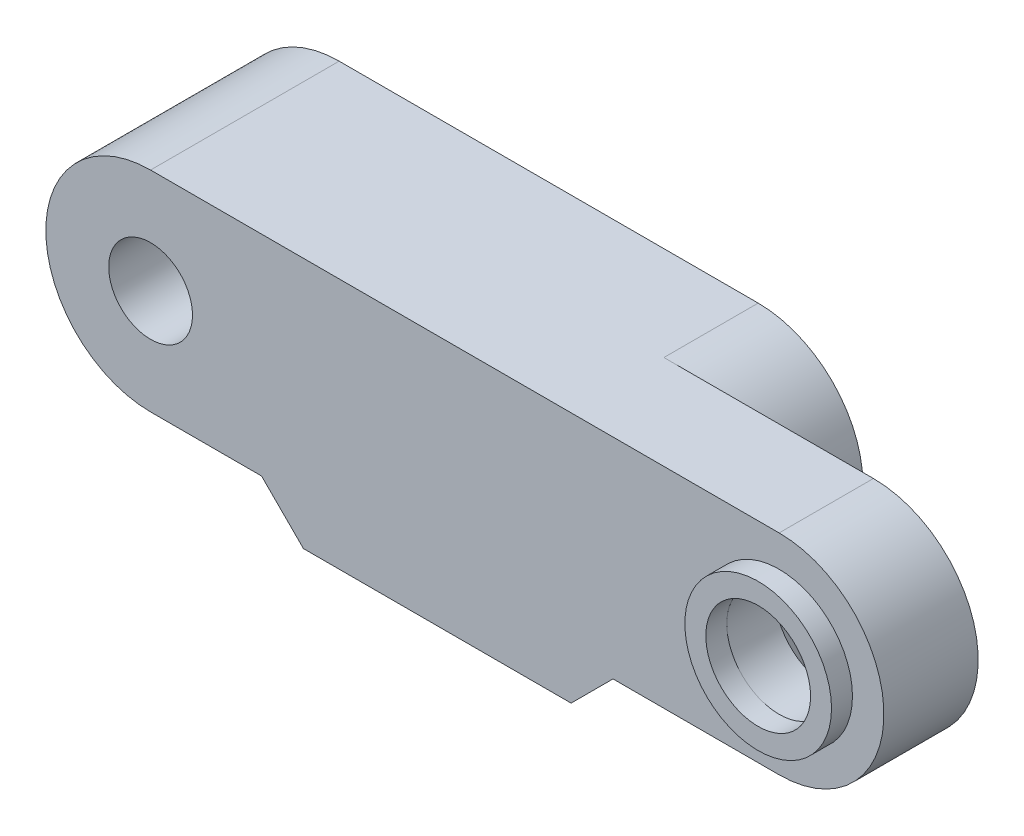
from build123d import *

# Parameters (mm, degrees)
P_IDAT_VYSUNUT_M1_DEPTH                           = 9
SKICA2_R                                          = 2
SKICA2_R_2                                        = 2.55
ODEBRAT_VYSUNUT_M1_DEPTH                          = 10
SKICA4_OUTSIDE_W                                  = 50.44
SKICA4_OUTSIDE_H                                  = 20.44
ODEBRAT_VYSUNUT_M5_DEPTH                          = 4.5
KU_ELOV_ZAHLOUBEN_PRO_M4_ROUBU_SE_Z_P_D           = 4.5
KU_ELOV_ZAHLOUBEN_PRO_M4_ROUBU_SE_Z_P_DEPTH       = 13.5
KU_ELOV_ZAHLOUBEN_PRO_M4_ROUBU_SE_Z_P_CSINK_D     = 9.4
KU_ELOV_ZAHLOUBEN_PRO_M4_ROUBU_SE_Z_P_CSINK_ANGLE = 90
KU_ELOV_ZAHLOUBEN_PRO_M4_ROUBU_SE_Z_P_TIP         = 1.351936393
SKICA14_R                                         = 3.5
SKICA14_R_2                                       = 2.5
P_IDAT_VYSUNUT_M3_DEPTH                           = 1
P_IDAT_VYSUNUT_M5_REACH                           = 38.742
SKICA15_R                                         = 2


with BuildPart() as part:
    # Skica1 → Přidat vysunutím1 (new body)
    with BuildSketch(Plane.XY):
        with BuildLine():
            Line((0, 5), (30, 5))
            ThreePointArc((30, 5), (35, 0), (30, -5))
            Line((30, -5), (0, -5))
            ThreePointArc((0, -5), (-5, 0), (0, 5))
        make_face()
    extrude(amount=P_IDAT_VYSUNUT_M1_DEPTH)

    # Skica2 → Odebrat vysunutím1 (cut)
    with BuildSketch(Plane.XY.offset(9)):
        Circle(SKICA2_R)
        with Locations((30, 0)):
            Circle(SKICA2_R_2)
    extrude(amount=-ODEBRAT_VYSUNUT_M1_DEPTH, mode=Mode.SUBTRACT)

    # Skica4 outside → Odebrat vysunutím5 (cut)
    with BuildSketch(Plane(origin=(0, 0, 0), x_dir=(-1, 0, 0), z_dir=(0, 0, -1))):
        with Locations((-15, 0)):
            Rectangle(SKICA4_OUTSIDE_W, SKICA4_OUTSIDE_H)
        with BuildLine():
            Line((0, -5), (-20, -5))
            ThreePointArc((-20, -5), (-25, 0), (-20, 5))
            Line((-20, 5), (0, 5))
            ThreePointArc((0, 5), (5, 0), (0, -5))
        make_face(mode=Mode.SUBTRACT)
    extrude(amount=-ODEBRAT_VYSUNUT_M5_DEPTH, mode=Mode.SUBTRACT)

    # Kuželové zahloubení pro M4 šroubu se zápustnou hlavou plochou1
    with Locations(Plane(origin=(0, 0, 4.5), x_dir=(-1, 0, 0), z_dir=(0, 0, -1))):
        with Locations((-30, 0)):
            CounterSinkHole(KU_ELOV_ZAHLOUBEN_PRO_M4_ROUBU_SE_Z_P_D / 2, KU_ELOV_ZAHLOUBEN_PRO_M4_ROUBU_SE_Z_P_CSINK_D / 2, depth=KU_ELOV_ZAHLOUBEN_PRO_M4_ROUBU_SE_Z_P_DEPTH, counter_sink_angle=KU_ELOV_ZAHLOUBEN_PRO_M4_ROUBU_SE_Z_P_CSINK_ANGLE)
            with Locations((0, 0, -(KU_ELOV_ZAHLOUBEN_PRO_M4_ROUBU_SE_Z_P_DEPTH + KU_ELOV_ZAHLOUBEN_PRO_M4_ROUBU_SE_Z_P_TIP / 2))):  # 118° drill point
                Cone(0, KU_ELOV_ZAHLOUBEN_PRO_M4_ROUBU_SE_Z_P_D / 2, KU_ELOV_ZAHLOUBEN_PRO_M4_ROUBU_SE_Z_P_TIP, mode=Mode.SUBTRACT)

    # Skica14 → Přidat vysunutím3 (add)
    with BuildSketch(Plane.XY.offset(9)):
        with Locations((30, 0)):
            Circle(SKICA14_R)
        with Locations((30, 0)):
            Circle(SKICA14_R_2, mode=Mode.SUBTRACT)
    extrude(amount=P_IDAT_VYSUNUT_M3_DEPTH)

    # Přidat vysunutím5: up to this face of the body (flat: up to its plane)
    p_idat_vysunut_m5_end = Plane(part.part.faces().sort_by_distance((13.81286954, 0, 9))[0])
    # Skica15 → Přidat vysunutím5 (add, up to the picked face)
    with BuildSketch(Plane(origin=(0, 0, 0), x_dir=(-1, 0, 0), z_dir=(0, 0, -1)), mode=Mode.PRIVATE) as p_idat_vysunut_m5_sk1:
        with BuildLine():
            Line((-25, 0), (-5.295627791, 0))
            Line((-5.295627791, 0), (-5.295627791, -5))
            Line((-5.295627791, -5), (0, -5))
            ThreePointArc((0, -5), (5, 0), (0, 5))
            Line((0, 5), (-20, 5))
            ThreePointArc((-20, 5), (-23.535533906, 3.535533906), (-25, 0))
        make_face()
        with Locations(Location((0, 0, 0), (0, 0, 180))):
            Circle(SKICA15_R, mode=Mode.SUBTRACT)
    p_idat_vysunut_m5_tool1 = split(extrude(p_idat_vysunut_m5_sk1.sketch, amount=-P_IDAT_VYSUNUT_M5_REACH, mode=Mode.PRIVATE), bisect_by=p_idat_vysunut_m5_end, keep=Keep.BOTH, mode=Mode.PRIVATE)
    # Skica15 → Přidat vysunutím5 (add, up to the picked face)
    with BuildSketch(Plane(origin=(0, 0, 0), x_dir=(-1, 0, 0), z_dir=(0, 0, -1)), mode=Mode.PRIVATE) as p_idat_vysunut_m5_sk2:
        with BuildLine():
            Line((-7.295627791, -7), (-5.295627791, -5))
            Line((-5.295627791, -5), (-20, -5))
            ThreePointArc((-20, -5), (-21.913417162, -4.619397663), (-23.535533906, -3.535533906))
            Line((-23.535533906, -3.535533906), (-20.071067812, -7))
            Line((-20.071067812, -7), (-7.295627791, -7))
        make_face()
    p_idat_vysunut_m5_tool2 = split(extrude(p_idat_vysunut_m5_sk2.sketch, amount=-P_IDAT_VYSUNUT_M5_REACH, mode=Mode.PRIVATE), bisect_by=p_idat_vysunut_m5_end, keep=Keep.BOTH, mode=Mode.PRIVATE)
    add(p_idat_vysunut_m5_tool1.solids().sort_by(Axis((8.223408, 1.304685, 0), (0, 0, 1)))[0])
    add(p_idat_vysunut_m5_tool2.solids().sort_by(Axis((13.831058, -5.932433, 0), (0, 0, 1)))[0])


solid = part.part
